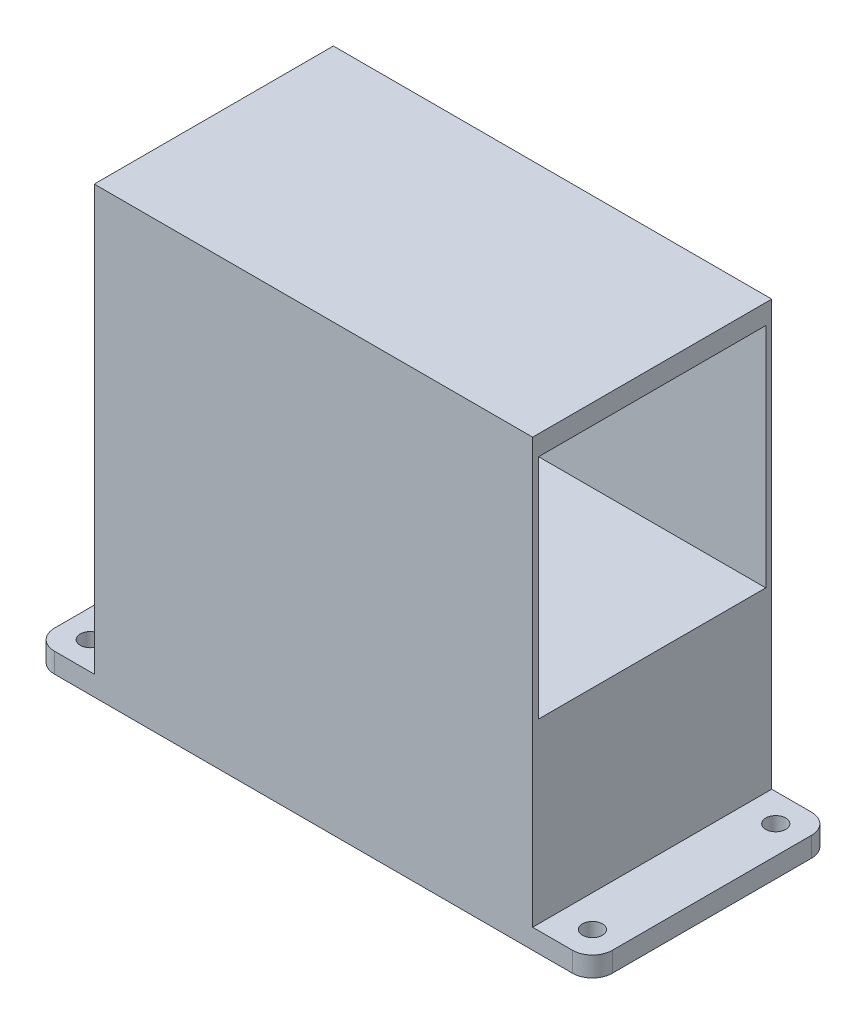
from build123d import *

# Parameters (mm, degrees)
SKETCH_1_W          = 140
SKETCH_1_H          = 60
EXTRUDE_3_DEPTH     = 5
SKETCH_3_W          = 110
SKETCH_3_H          = 60
EXTRUDE_4_DEPTH     = 106.5
FILLET_1_R          = 5
SKETCH_19_W         = 57
SKETCH_19_H         = 57
CUT_EXTRUDE_1_DEPTH = 160
HOLE_WIZARD_M6_2_D  = 5


with BuildPart() as part:
    # 草图1 → 凸台-拉伸3 (new body)
    with BuildSketch(Plane(origin=(0, 0, 0), x_dir=(1, 0, 0), z_dir=(0, 1, 0))):
        Rectangle(SKETCH_1_W, SKETCH_1_H)
    extrude(amount=EXTRUDE_3_DEPTH)

    # 草图3 → 凸台-拉伸4 (add)
    with BuildSketch(Plane(origin=(0, 5, 0), x_dir=(1, 0, 0), z_dir=(0, 1, 0))):
        Rectangle(SKETCH_3_W, SKETCH_3_H)
    extrude(amount=EXTRUDE_4_DEPTH)

    # 圆角1
    fillet_1_edges = [part.edges().sort_by_distance(p)[0] for p in [
        (70, 2.5, 30),
        (-70, 2.5, 30),
        (-70, 2.5, -30),
        (70, 2.5, -30),
    ]]
    fillet(fillet_1_edges, radius=FILLET_1_R)

    # 草图19 → 切除-拉伸1 (cut)
    with BuildSketch(Plane.ZY.offset(55)):
        with Locations((0, 78)):
            Rectangle(SKETCH_19_W, SKETCH_19_H)
    extrude(amount=-CUT_EXTRUDE_1_DEPTH, mode=Mode.SUBTRACT)

    # M6 螺纹孔2 (through all)
    with Locations(Plane(origin=(0, 5, 0), x_dir=(1, 0, 0), z_dir=(0, 1, 0))):
        with Locations((-63, 23), (63, 23), (63, -23), (-63, -23)):
            Hole(HOLE_WIZARD_M6_2_D / 2)


solid = part.part
